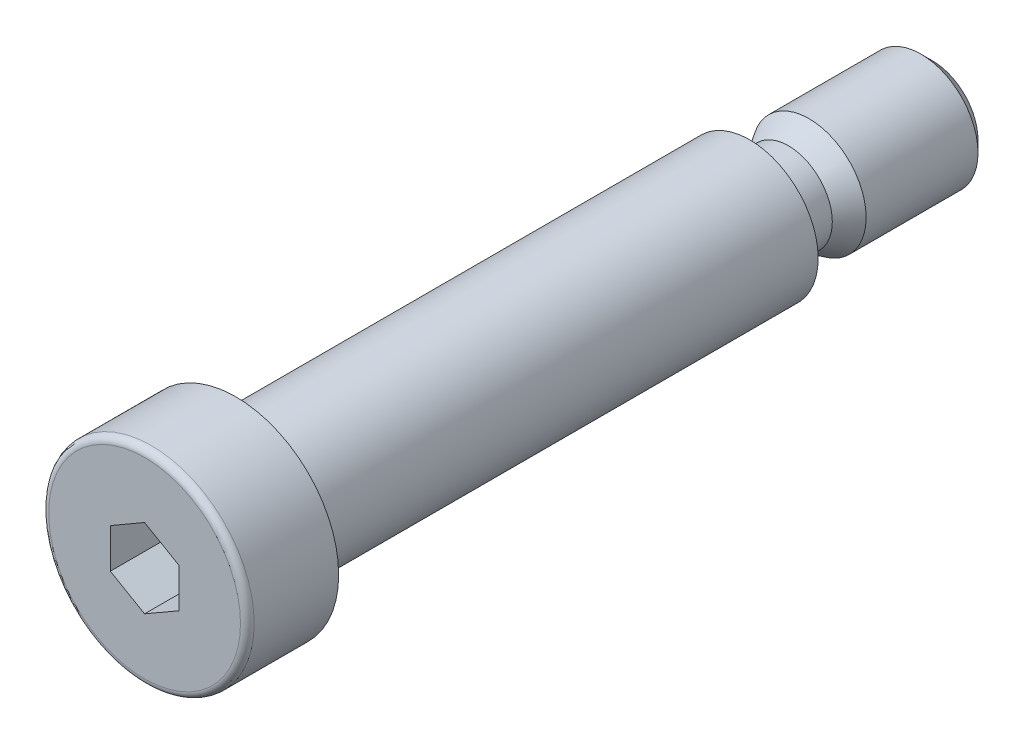
from build123d import *

# Parameters (mm, degrees)
SZKIC1_W                   = 3.85
SZKIC1_H                   = 3.39
WYTNIJ_WYCI_GNI_CIE1_DEPTH = 4.9
ZAOKR_GLENIE1_R            = 0.6


with BuildPart() as part:
    # Szkic1 → Obrót1 (revolve)
    with BuildSketch(Plane(origin=(0, 0, 0), x_dir=(1, 0, 0), z_dir=(0, 1, 0)), mode=Mode.PRIVATE) as obr_t1_sk:
        Polygon((0, -30.5), (0, -22.5), (-6, -22.5), (-9, -22.5), (-9, -30.5), align=None)
        Polygon((0, -22.5), (0, 22.5), (-3.85, 22.5), (-6, 22.5), (-6, -22.5), align=None)
        with Locations((-1.925, 24.195)):
            Rectangle(SZKIC1_W, SZKIC1_H)
        Polygon((-3.85, 25.89), (0, 25.89), (0, 38.5), (-4, 38.5), (-5, 37.5), (-5, 27.7), align=None)
    revolve(obr_t1_sk.sketch.rotate(Axis((0, 0, 30.5), (0, 0, -1)), 180), axis=Axis((0, 0, 30.5), (0, 0, -1)))

    # Szkic2 → Wytnij-wyciągnięcie1 (cut)
    with BuildSketch(Plane.XY.offset(30.5)):
        Polygon((3, 1.732050808), (0, 3.464101615), (-3, 1.732050808), (-3, -1.732050808), (0, -3.464101615), (3, -1.732050808), align=None)
    extrude(amount=-WYTNIJ_WYCI_GNI_CIE1_DEPTH, mode=Mode.SUBTRACT)

    # Zaokrąglenie1
    zaokr_glenie1_edges = [part.edges().sort_by_distance(p)[0] for p in [
        (-9, 0, 30.5),
    ]]
    fillet(zaokr_glenie1_edges, radius=ZAOKR_GLENIE1_R)


solid = part.part
